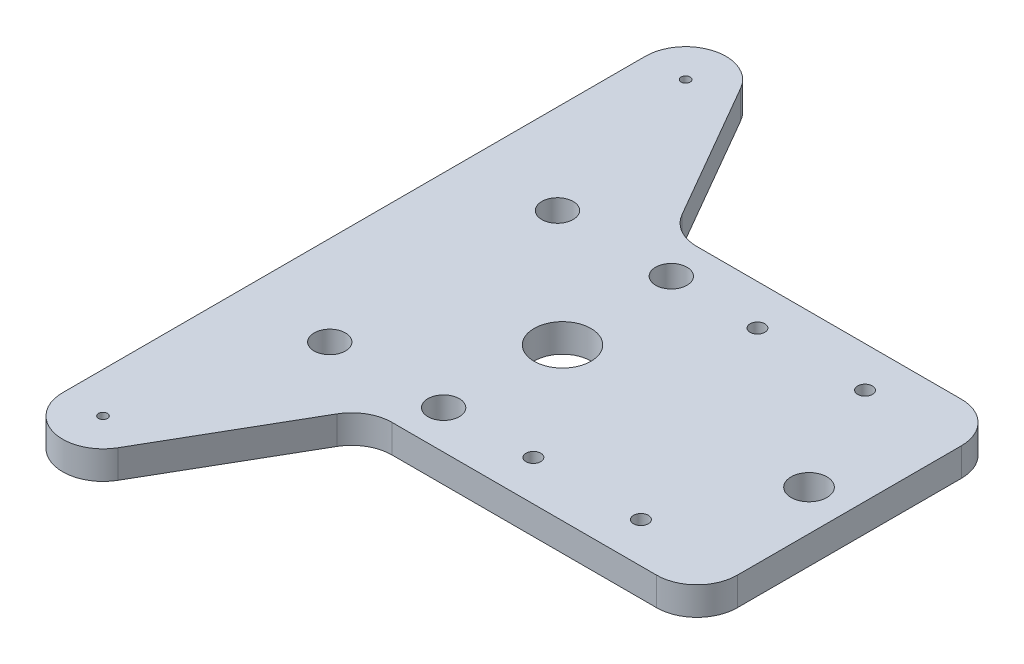
from build123d import *

# Parameters (mm, degrees)
SKETCH1_R           = 1
SKETCH1_R_2         = 6.35
SKETCH1_R_3         = 4
SKETCH1_R_4         = 3.5
SKETCH1_R_5         = 1.65
BOSS_EXTRUDE3_DEPTH = 6.3


with BuildPart() as part:
    # Sketch1 → Boss-Extrude3 (new body)
    with BuildSketch(Plane(origin=(0, 0, 0), x_dir=(1, 0, 0), z_dir=(0, 1, 0))):
        with BuildLine():
            Line((0, -65), (0, 65))
            ThreePointArc((0, 65), (6.670628594, 73.693332437), (16.794228634, 69.5))
            Line((16.794228634, 69.5), (34.692086979, 38.5))
            ThreePointArc((34.692086979, 38.5), (37.986315613, 35.205771366), (42.486315613, 34))
            Line((42.486315613, 34), (101.527767497, 34))
            ThreePointArc((101.527767497, 34), (107.891728528, 31.363961031), (110.527767497, 25))
            Line((110.527767497, 25), (110.527767497, -25))
            ThreePointArc((110.527767497, -25), (107.891728528, -31.363961031), (101.527767497, -34))
            Line((101.527767497, -34), (42.486315613, -34))
            ThreePointArc((42.486315613, -34), (37.986315613, -35.205771366), (34.692086979, -38.5))
            Line((34.692086979, -38.5), (16.794228634, -69.5))
            ThreePointArc((16.794228634, -69.5), (6.670628594, -73.693332437), (0, -65))
        make_face()
        with Locations(Location((9, 65, 0), (0, 0, 270))):
            Circle(SKETCH1_R, mode=Mode.SUBTRACT)
        with Locations(Location((46.527767497, 0, 0), (0, 0, 90))):
            Circle(SKETCH1_R_2, mode=Mode.SUBTRACT)
        with Locations(Location((101.527767497, 0, 0), (0, 0, 90))):
            Circle(SKETCH1_R_3, mode=Mode.SUBTRACT)
        with Locations(Location((20, 25.4, 0), (0, 0, 270))):
            Circle(SKETCH1_R_4, mode=Mode.SUBTRACT)
        with Locations(Location((45.4, 25.4, 0), (0, 0, 270))):
            Circle(SKETCH1_R_4, mode=Mode.SUBTRACT)
        with Locations(Location((45.4, -25.4, 0), (0, 0, 90))):
            Circle(SKETCH1_R_4, mode=Mode.SUBTRACT)
        with Locations(Location((20, -25.4, 0), (0, 0, 90))):
            Circle(SKETCH1_R_4, mode=Mode.SUBTRACT)
        with Locations(Location((9, -65, 0), (0, 0, 90))):
            Circle(SKETCH1_R, mode=Mode.SUBTRACT)
        with Locations(Location((89.027767497, -25, 0), (0, 0, 270))):
            Circle(SKETCH1_R_5, mode=Mode.SUBTRACT)
        with Locations(Location((65.027767497, -25, 0), (0, 0, 270))):
            Circle(SKETCH1_R_5, mode=Mode.SUBTRACT)
        with Locations(Location((65.027767497, 25, 0), (0, 0, 90))):
            Circle(SKETCH1_R_5, mode=Mode.SUBTRACT)
        with Locations(Location((89.027767497, 25, 0), (0, 0, 90))):
            Circle(SKETCH1_R_5, mode=Mode.SUBTRACT)
    extrude(amount=BOSS_EXTRUDE3_DEPTH)


solid = part.part
